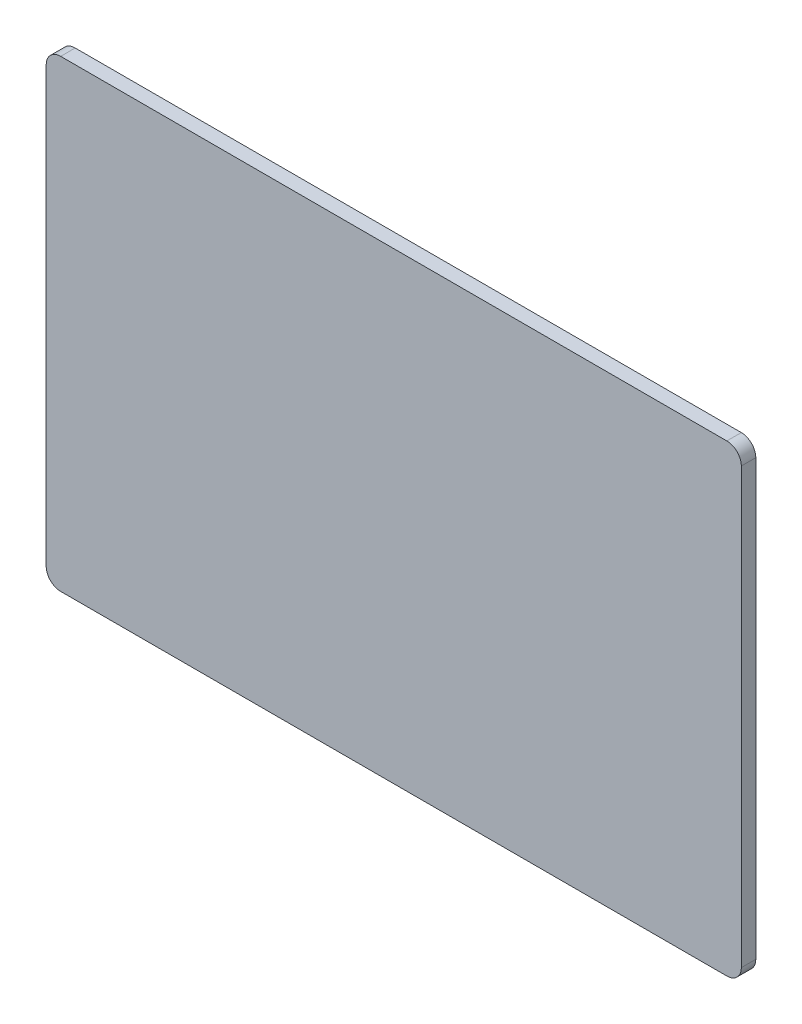
from build123d import *

# Parameters (mm, degrees)
SKETCH1_W           = 76.2
SKETCH1_H           = 50.8
BOSS_EXTRUDE1_DEPTH = 1.5875
FILLET1_R           = 1.5875


with BuildPart() as part:
    # Sketch1 → Boss-Extrude1 (new body)
    with BuildSketch(Plane.XY):
        with Locations((38.1, 25.4)):
            Rectangle(SKETCH1_W, SKETCH1_H)
    extrude(amount=BOSS_EXTRUDE1_DEPTH)

    # Fillet1
    fillet1_edges = [part.edges().sort_by_distance(p)[0] for p in [
        (0, 50.8, 0.79375),
        (76.2, 50.8, 0.79375),
        (76.2, 0, 0.79375),
        (0, 0, 0.79375),
    ]]
    fillet(fillet1_edges, radius=FILLET1_R)


solid = part.part
